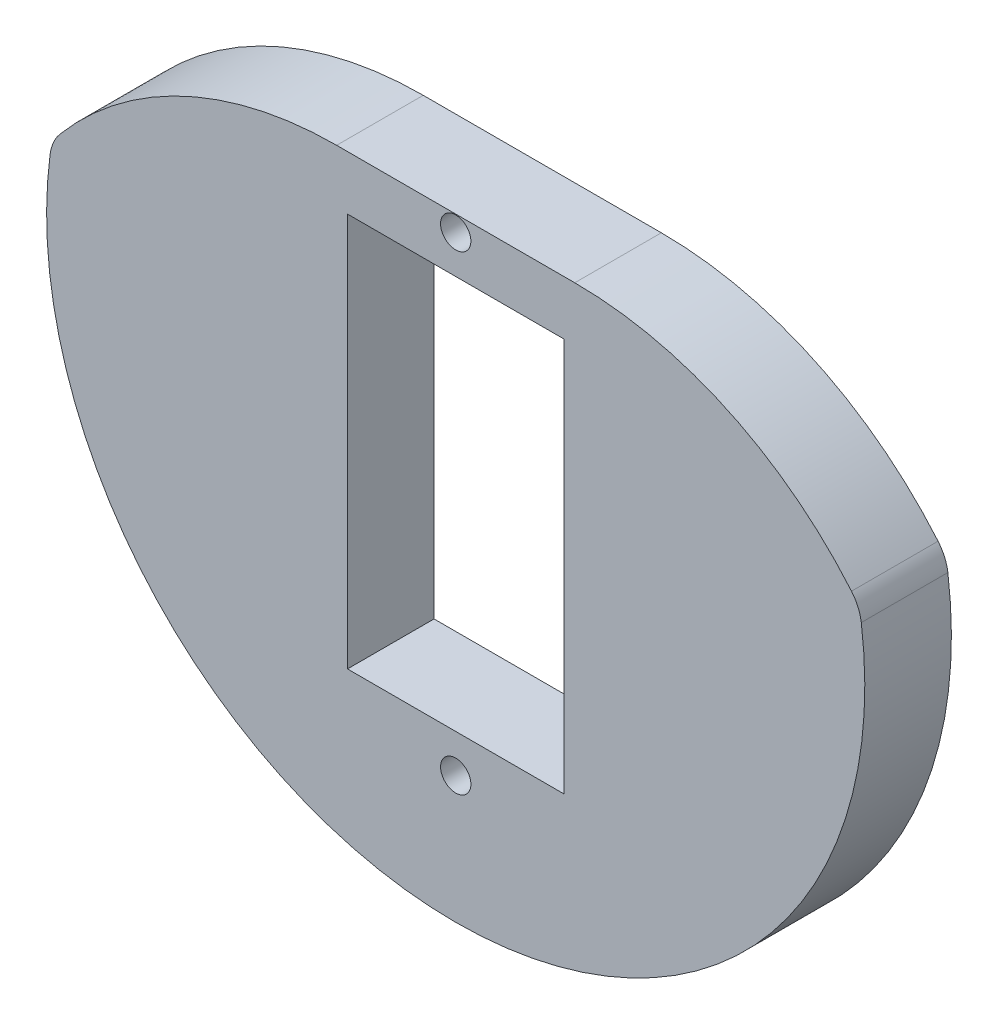
from build123d import *

# Parameters (mm, degrees)
BOSS_EXTRUDE1_DEPTH = 5.08
FILLET1_R           = 2.54
SKETCH5_R           = 0.889
SKETCH5_W           = 12.7
SKETCH5_H           = 23.114
CUT_EXTRUDE1_DEPTH  = 35.323380204


with BuildPart() as part:
    # Sketch1 → Boss-Extrude1 (new body)
    with BuildSketch(Plane.XY):
        with BuildLine():
            Line((-6.985, 11.9888), (6.985, 11.9888))
            ThreePointArc((6.985, 11.9888), (16.273931797, 9.848966937), (23.69046712, 3.8608))
            ThreePointArc((23.69046712, 3.8608), (0, -24.003), (-23.69046712, 3.8608))
            ThreePointArc((-23.69046712, 3.8608), (-16.273931797, 9.848966937), (-6.985, 11.9888))
        make_face()
    extrude(amount=BOSS_EXTRUDE1_DEPTH)

    # Fillet1
    fillet1_edges = [part.edges().sort_by_distance(p)[0] for p in [
        (23.69046712, 3.8608, 2.54),
        (-23.69046712, 3.8608, 2.54),
    ]]
    fillet(fillet1_edges, radius=FILLET1_R)

    # Sketch5 → Cut-Extrude1 (cut, through all)
    with BuildSketch(Plane.XY.offset(5.08)):
        with Locations((0, -16.54175)):
            Circle(SKETCH5_R)
        with Locations((0, 11.05535)):
            Circle(SKETCH5_R)
        with Locations((0, -2.7432)):
            Rectangle(SKETCH5_W, SKETCH5_H)
    extrude(amount=-CUT_EXTRUDE1_DEPTH, mode=Mode.SUBTRACT)


solid = part.part
